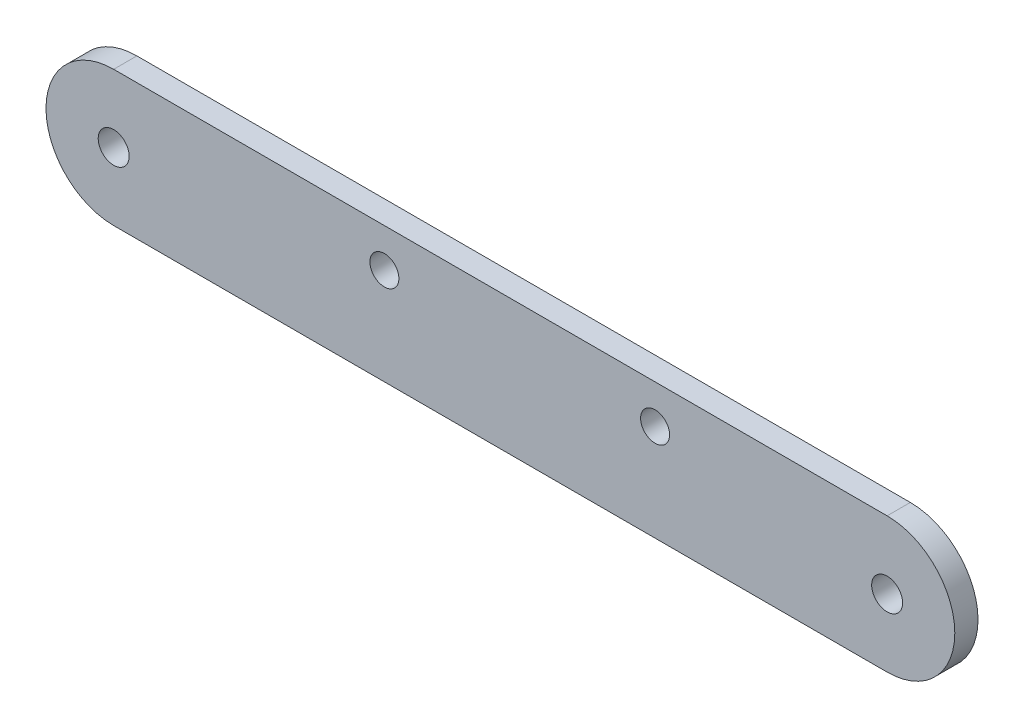
from build123d import *

# Parameters (mm, degrees)
ESQUISSE1_R             = 4
BOSS_EXTRU_1_DEPTH      = 6
ENL_V_MAT_EXTRU_1_REACH = 134.912
ESQUISSE2_R             = 3.75


with BuildPart() as part:
    # Esquisse1 → Boss.-Extru.1 (new body)
    with BuildSketch(Plane.XY):
        with BuildLine():
            Line((-114.118449195, 17.5), (85.881550805, 17.5))
            ThreePointArc((85.881550805, 17.5), (103.381550805, 0), (85.881550805, -17.5))
            Line((85.881550805, -17.5), (-114.118449195, -17.5))
            ThreePointArc((-114.118449195, -17.5), (-131.618449195, 0), (-114.118449195, 17.5))
        make_face()
        with Locations((-114.118449195, 0)):
            Circle(ESQUISSE1_R, mode=Mode.SUBTRACT)
        with Locations((85.881550805, 0)):
            Circle(ESQUISSE1_R, mode=Mode.SUBTRACT)
    extrude(amount=BOSS_EXTRU_1_DEPTH)

    # Esquisse2 → Enlèv. mat.-Extru.1 (cut, up to next)
    with BuildSketch(Plane.XY.offset(6), mode=Mode.PRIVATE) as enl_v_mat_extru_1_sk1:
        with Locations((-44.118449195, 7.5)):
            Circle(ESQUISSE2_R)
    enl_v_mat_extru_1_tool1 = extrude(enl_v_mat_extru_1_sk1.sketch, amount=-ENL_V_MAT_EXTRU_1_REACH, mode=Mode.PRIVATE) & part.part
    # Esquisse2 → Enlèv. mat.-Extru.1 (cut, up to next)
    with BuildSketch(Plane.XY.offset(6), mode=Mode.PRIVATE) as enl_v_mat_extru_1_sk2:
        with Locations((25.881550805, 7.5)):
            Circle(ESQUISSE2_R)
    enl_v_mat_extru_1_tool2 = extrude(enl_v_mat_extru_1_sk2.sketch, amount=-ENL_V_MAT_EXTRU_1_REACH, mode=Mode.PRIVATE) & part.part
    add(enl_v_mat_extru_1_tool1.solids().sort_by_distance((-44.118449, 7.5, 6))[0], mode=Mode.SUBTRACT)
    add(enl_v_mat_extru_1_tool2.solids().sort_by_distance((25.881551, 7.5, 6))[0], mode=Mode.SUBTRACT)


solid = part.part
